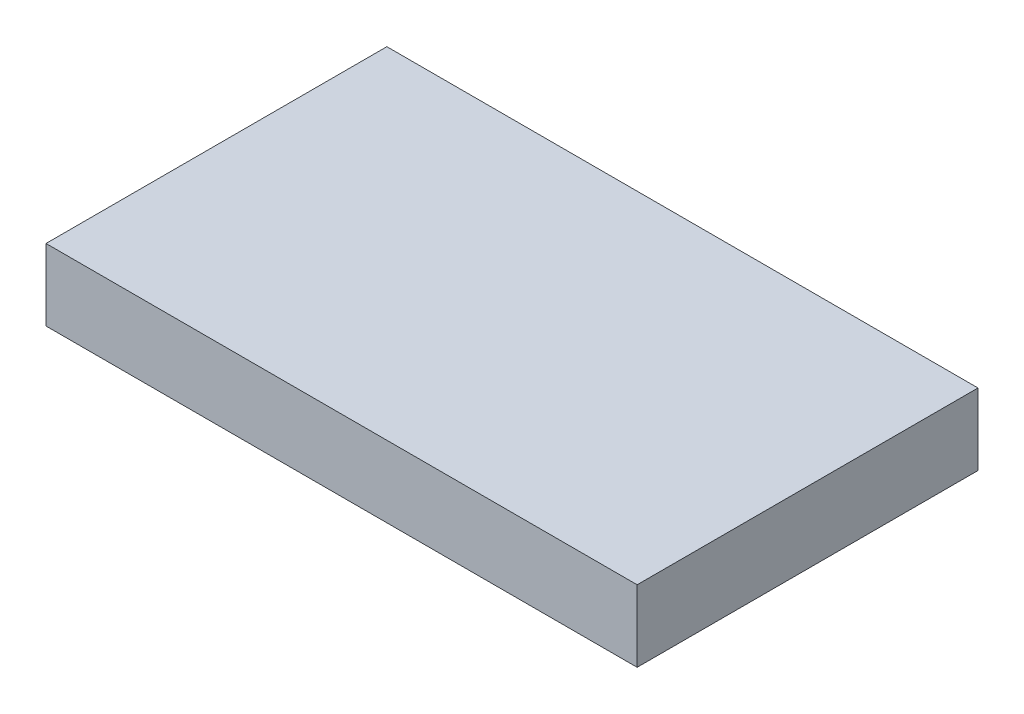
from build123d import *

# Parameters (mm, degrees)
SKETCH1_W           = 24.8
SKETCH1_H           = 14.3
BOSS_EXTRUDE1_DEPTH = 3


with BuildPart() as part:
    # Sketch1 → Boss-Extrude1 (new body)
    with BuildSketch(Plane(origin=(0, 0, 0), x_dir=(1, 0, 0), z_dir=(0, 1, 0))):
        with Locations((-16.095364238, 14.693708609)):
            Rectangle(SKETCH1_W, SKETCH1_H)
    extrude(amount=BOSS_EXTRUDE1_DEPTH)


solid = part.part
